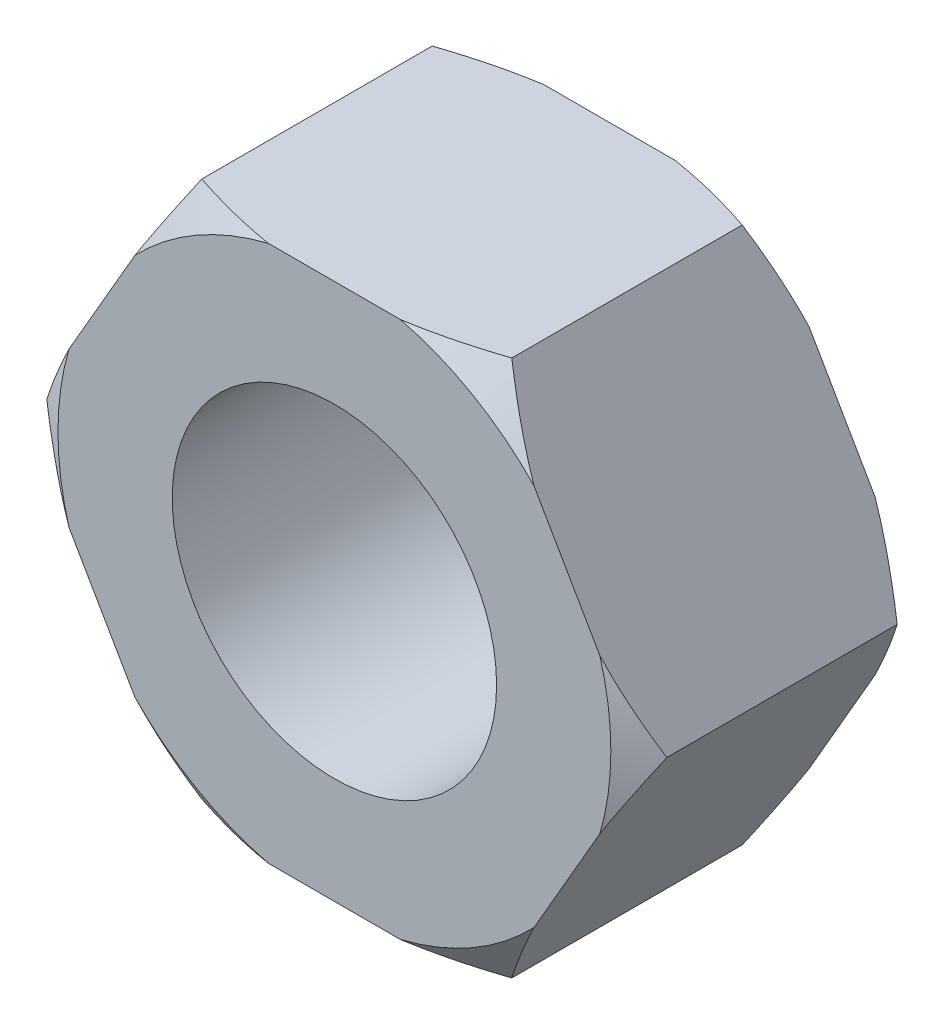
from build123d import *

# Parameters (mm, degrees)
IZIM1_R                     = 7.25
Y_KSEKLIK_EKSTR_ZYON1_DEPTH = 12.3


with BuildPart() as part:
    # Çizim1 → Yükseklik-Ekstrüzyon1 (new body)
    with BuildSketch(Plane.XY):
        Polygon((13.856406461, 0), (6.92820323, 12), (-6.92820323, 12), (-13.856406461, 0), (-6.92820323, -12), (6.92820323, -12), align=None)
        Circle(IZIM1_R, mode=Mode.SUBTRACT)
    extrude(amount=Y_KSEKLIK_EKSTR_ZYON1_DEPTH)

    # Çizim2 → Kes-Döndür1 (revolve, cut)
    with BuildSketch(Plane(origin=(0, 0, 0), x_dir=(1, 0, 0), z_dir=(0, 1, 0))):
        Polygon((-13.856406461, 0), (-12.356406461, 0), (-13.856406461, -1), align=None)
        Polygon((-13.856406461, -12.3), (-13.856406461, -11.3), (-12.356406461, -12.3), align=None)
    revolve(axis=Axis((0, 0, 0), (0, 0, 1)), mode=Mode.SUBTRACT)


solid = part.part
